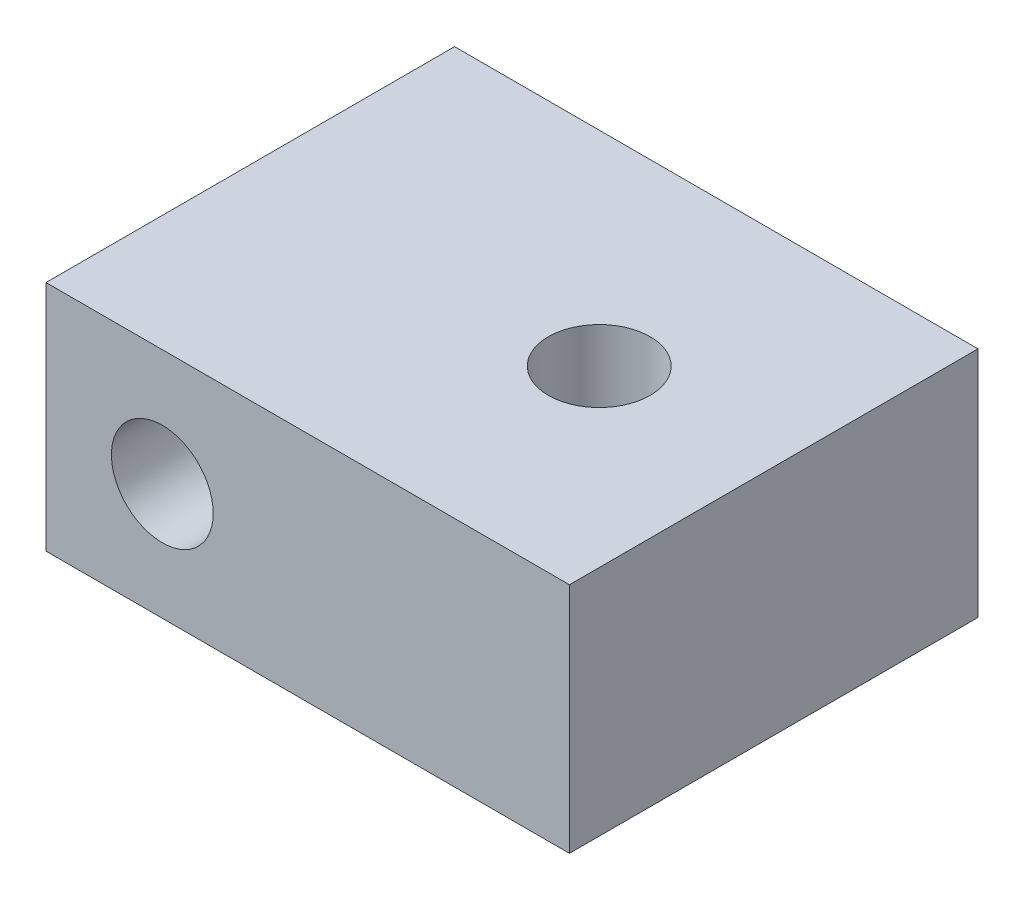
from build123d import *

# Parameters (mm, degrees)
SKETCH1_W           = 8
SKETCH1_H           = 8
BOSS_EXTRUDE1_DEPTH = 14.05
SKETCH2_R           = 1.75
CUT_EXTRUDE1_DEPTH  = 16.308633478
SKETCH3_W           = 14.05
SKETCH3_H           = 8
BOSS_EXTRUDE2_DEPTH = 10
SKETCH4_R           = 1.75
CUT_EXTRUDE2_DEPTH  = 22.586444055


with BuildPart() as part:
    # Sketch1 → Boss-Extrude1 (new body)
    with BuildSketch(Plane.XY):
        with Locations((0.302869186, -0.293841606)):
            Rectangle(SKETCH1_W, SKETCH1_H)
    extrude(amount=BOSS_EXTRUDE1_DEPTH)

    # Sketch2 → Cut-Extrude1 (cut, through all)
    with BuildSketch(Plane.XY.offset(14.05)):
        with Locations((0.302869186, -0.293841606)):
            Circle(SKETCH2_R)
    extrude(amount=-CUT_EXTRUDE1_DEPTH, mode=Mode.SUBTRACT)

    # Sketch3 → Boss-Extrude2 (add)
    with BuildSketch(Plane(origin=(4.302869186, 0, 0), x_dir=(0, 0, -1), z_dir=(1, 0, 0))):
        with Locations((-7.025, -0.293841606)):
            Rectangle(SKETCH3_W, SKETCH3_H)
    extrude(amount=BOSS_EXTRUDE2_DEPTH)

    # Sketch4 → Cut-Extrude2 (cut, through all)
    with BuildSketch(Plane(origin=(0, 3.706158394, 0), x_dir=(1, 0, 0), z_dir=(0, 1, 0))):
        with Locations(Location((8.302869186, -7.025, 0), (0, 0, 270))):
            Circle(SKETCH4_R)
    extrude(amount=-CUT_EXTRUDE2_DEPTH, mode=Mode.SUBTRACT)


solid = part.part
